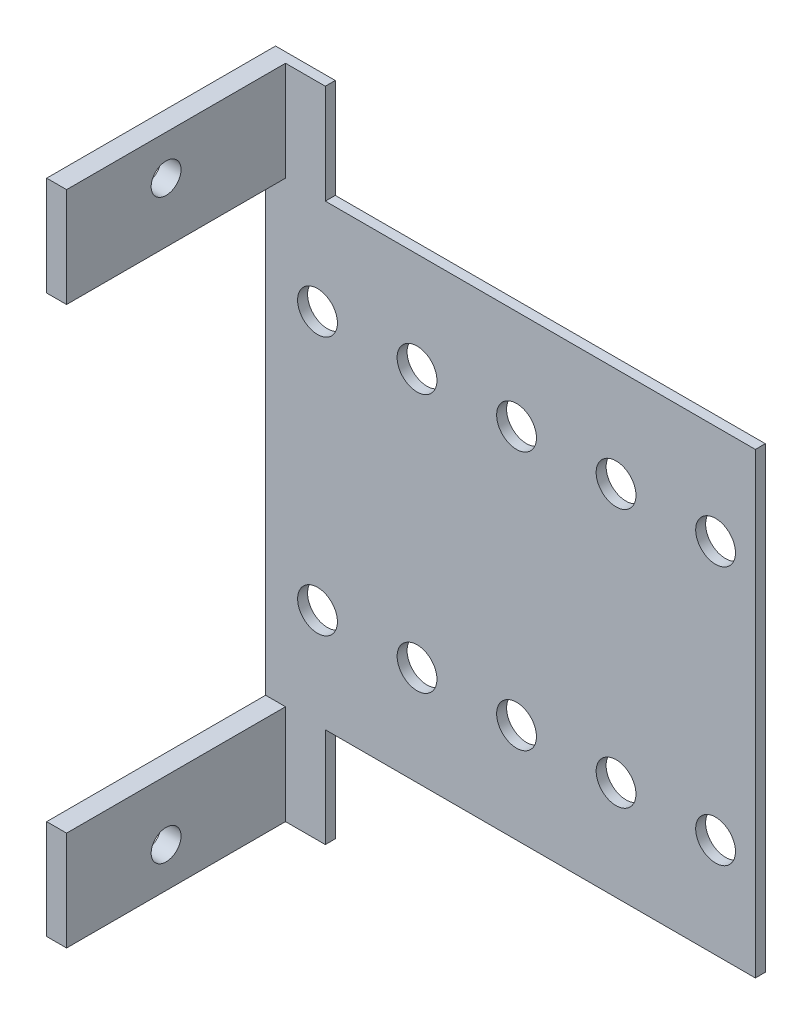
from build123d import *

# Parameters (mm, degrees)
BOSS_EXTRU_1_DEPTH      = 0.5
ESQUISSE2_W             = 1
ESQUISSE2_H             = 5
BOSS_EXTRU_2_DEPTH      = 11
ESQUISSE6_R             = 1
ENL_V_MAT_EXTRU_3_DEPTH = 11
ESQUISSE7_R             = 0.75
ENL_V_MAT_EXTRU_4_DEPTH = 11


with BuildPart() as part:
    # Esquisse1 → Boss.-Extru.1 (new body)
    with BuildSketch(Plane.XY):
        Polygon((3, 5), (24.608143501, 5), (24.608143501, 28), (3, 28), (3, 33), (0, 33), (0, 0), (3, 0), align=None)
    extrude(amount=BOSS_EXTRU_1_DEPTH)

    # Esquisse2 → Boss.-Extru.2 (add)
    with BuildSketch(Plane.XY.offset(0.5)):
        with Locations((0.5, 30.5)):
            Rectangle(ESQUISSE2_W, ESQUISSE2_H)
        with Locations((0.5, 2.5)):
            Rectangle(ESQUISSE2_W, ESQUISSE2_H)
    extrude(amount=BOSS_EXTRU_2_DEPTH)

    # Esquisse6 → Enlèv. mat.-Extru.3 (cut)
    with BuildSketch(Plane.XY.offset(0.5)):
        with Locations((22.608143501, 10)):
            Circle(ESQUISSE6_R)
        with Locations((17.608143501, 10)):
            Circle(ESQUISSE6_R)
        with Locations((12.608143501, 10)):
            Circle(ESQUISSE6_R)
        with Locations((7.608143501, 10)):
            Circle(ESQUISSE6_R)
        with Locations((2.608143501, 10)):
            Circle(ESQUISSE6_R)
        with Locations((2.608143501, 23)):
            Circle(ESQUISSE6_R)
        with Locations((7.608143501, 23)):
            Circle(ESQUISSE6_R)
        with Locations((12.608143501, 23)):
            Circle(ESQUISSE6_R)
        with Locations((17.608143501, 23)):
            Circle(ESQUISSE6_R)
        with Locations((22.608143501, 23)):
            Circle(ESQUISSE6_R)
    extrude(amount=-ENL_V_MAT_EXTRU_3_DEPTH, mode=Mode.SUBTRACT)

    # Esquisse7 → Enlèv. mat.-Extru.4 (cut)
    with BuildSketch(Plane.ZY):
        with Locations((6.5, 31)):
            Circle(ESQUISSE7_R)
        with Locations(Location((6.5, 2, 0), (0, 0, 270))):
            Circle(ESQUISSE7_R)
    extrude(amount=-ENL_V_MAT_EXTRU_4_DEPTH, mode=Mode.SUBTRACT)


solid = part.part
